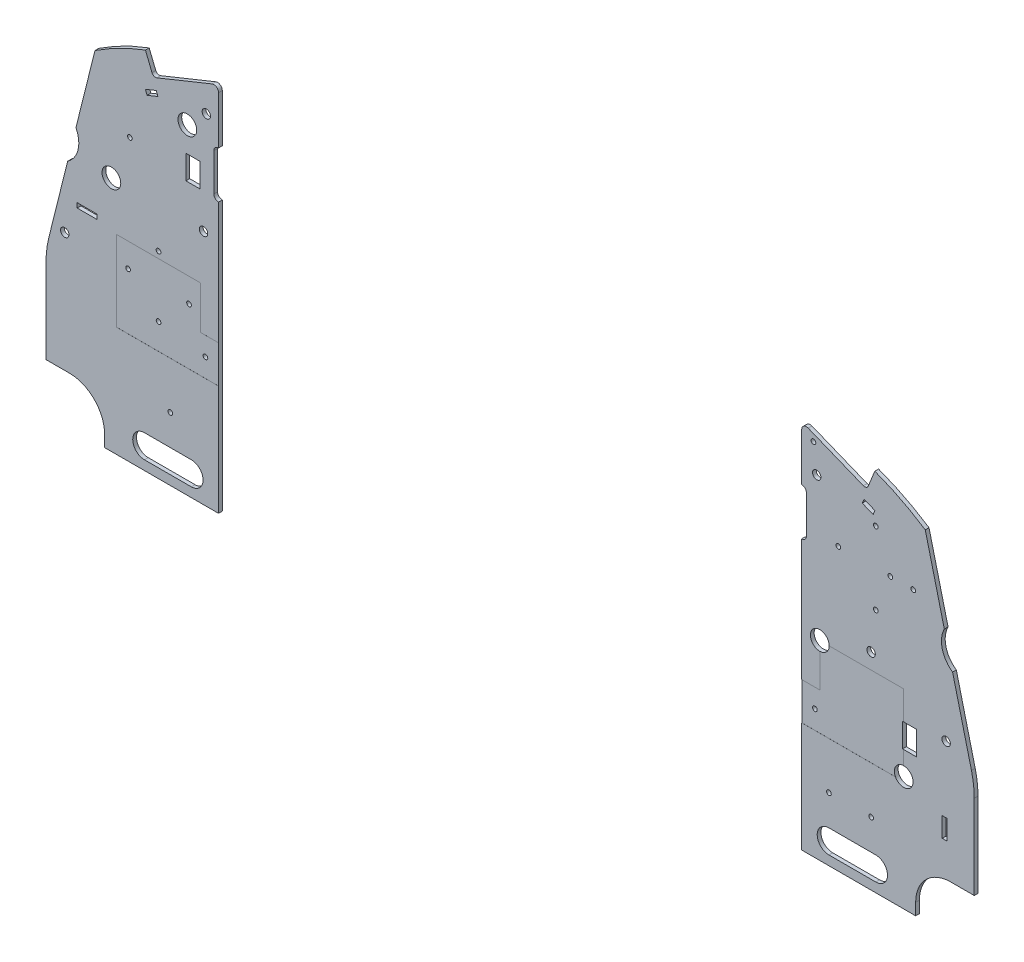
from build123d import *

# Parameters (mm, degrees)
AUFSATZ_LINEAR_AUSTRAGEN1_DEPTH      = 0.8
VERRUNDUNG1_R                        = 20
VERRUNDUNG3_R                        = 1
SKIZZE4_R                            = 5.5
SCHNITT_LINEAR_AUSTRAGEN2_DEPTH      = 130.32802365
SCHNITT_LINEAR_AUSTRAGEN3_DEPTH      = 130.32802365
SCHNITT_LINEAR_AUSTRAGEN3_DEPTH_BACK = 130.32802365
SKIZZE5_R                            = 0.5
VERRUNDUNG4_R                        = 0.8
SKIZZE3_R                            = 0.9
SKIZZE3_R_2                          = 2
SKIZZE3_R_3                          = 0.5
SKIZZE3_W                            = 3
SKIZZE3_H                            = 5.1
SKIZZE3_W_2                          = 4.20290216
SKIZZE3_H_2                          = 1
SKIZZE3_W_3                          = 1
SKIZZE3_H_3                          = 4.201269158
SCHNITT_LINEAR_AUSTRAGEN1_DEPTH      = 130.32802365
SCHNITT_LINEAR_AUSTRAGEN4_DEPTH      = 0.01


with BuildPart() as part:
    # Skizze2 → Aufsatz-Linear austragen1 (new body)
    with BuildSketch(Plane.XY.offset(13.9)):
        with BuildLine():
            Line((-94, 14.5), (-99, 14.5))
            Line((-99, 14.5), (-99, 34.929108521))
            Line((-99, 34.929108521), (-88.553693359, 76.826956023))
            ThreePointArc((-88.553693359, 76.826956023), (-83.331016666, 79.871233051), (-77.790323379, 82.288812905))
            Line((-77.790323379, 82.288812905), (-76.090498469, 78.081598618))
            Line((-76.090498469, 78.081598618), (-62.2, 83.693724289))
            Line((-62.2, 83.693724289), (-62.2, 4.5))
            Line((-62.2, 4.5), (-86.5, 4.5))
            Line((-86.5, 4.5), (-86.5, 7))
            ThreePointArc((-86.5, 7), (-88.696699141, 12.303300859), (-94, 14.5))
        make_face()
    extrude(amount=-AUFSATZ_LINEAR_AUSTRAGEN1_DEPTH)

    # Verrundung1
    verrundung1_edges = [part.edges().sort_by_distance(p)[0] for p in [
        (-99, 34.929108521, 13.5),
    ]]
    fillet(verrundung1_edges, radius=VERRUNDUNG1_R)

    # Verrundung3
    verrundung3_edges = [part.edges().sort_by_distance(p)[0] for p in [
        (-62.2, 83.693724289, 13.5),
    ]]
    fillet(verrundung3_edges, radius=VERRUNDUNG3_R)

    # Skizze4 → Schnitt-Linear austragen2 (cut, through all)
    with BuildSketch(Plane.XY.offset(13.9)):
        with Locations((-97.5, 58)):
            Circle(SKIZZE4_R)
    extrude(amount=-SCHNITT_LINEAR_AUSTRAGEN2_DEPTH, mode=Mode.SUBTRACT)

    # Skizze5 → Schnitt-Linear austragen3 (cut, two sides: drawn at the far end of the back side and taken through both)
    with BuildSketch(Plane.XY.offset(13.9).offset(-SCHNITT_LINEAR_AUSTRAGEN3_DEPTH_BACK)):
        with Locations((-65, 32)):
            Circle(SKIZZE5_R)
        with Locations((-81.1, 64.5)):
            Circle(SKIZZE5_R)
        with BuildLine():
            Line((-63.2, 63), (-63.2, 71))
            ThreePointArc((-63.2, 71), (-62.2, 72), (-61.2, 71))
            Line((-61.2, 71), (-61.2, 63))
            ThreePointArc((-61.2, 63), (-62.2, 62), (-63.2, 63))
        make_face()
        with BuildLine():
            Line((-78, 11.5), (-68, 11.5))
            ThreePointArc((-68, 11.5), (-65.5, 9), (-68, 6.5))
            Line((-68, 6.5), (-78, 6.5))
            ThreePointArc((-78, 6.5), (-80.5, 9), (-78, 11.5))
        make_face()
        Polygon((-77.808979818, 75.031741758), (-77.434373225, 74.104557904), (-75.116413588, 75.041074387), (-75.491020182, 75.968258242), align=None)
    extrude(amount=SCHNITT_LINEAR_AUSTRAGEN3_DEPTH + SCHNITT_LINEAR_AUSTRAGEN3_DEPTH_BACK, mode=Mode.SUBTRACT)

    # Verrundung4
    verrundung4_edges = [part.edges().sort_by_distance(p)[0] for p in [
        (-76.090498469, 78.081598618, 13.5),
    ]]
    fillet(verrundung4_edges, radius=VERRUNDUNG4_R)


with BuildPart() as body_2:
    # Spiegeln1: mirrored copy
    add(part.part.mirror(Plane(origin=(0, 0, 0), x_dir=(0, 0, 1), z_dir=(1, 0, 0))))


with BuildPart() as schnitt_linear_austragen1_tool:
    # Skizze3 → Schnitt-Linear austragen1 (new, through all)
    with BuildSketch(Plane.XY.offset(13.9)):
        with Locations((-64.8, 77)):
            Circle(SKIZZE3_R)
        with Locations((-68.85, 72.95)):
            Circle(SKIZZE3_R_2)
        with Locations((-85.05, 55.05)):
            Circle(SKIZZE3_R_2)
        with Locations((-65.4, 55)):
            Circle(SKIZZE3_R)
        with Locations((-95, 40)):
            Circle(SKIZZE3_R)
        with Locations((65.4, 75.4)):
            Circle(SKIZZE3_R)
        with Locations((77, 48.5)):
            Circle(SKIZZE3_R)
        with Locations((66.05, 45.15)):
            Circle(SKIZZE3_R_2)
        with Locations((83.95, 28.95)):
            Circle(SKIZZE3_R_2)
        with Locations((93, 40)):
            Circle(SKIZZE3_R)
        with Locations((64.7, 81.2)):
            Circle(SKIZZE3_R_3)
        with Locations((78, 72.250000005)):
            Circle(SKIZZE3_R_3)
        with Locations((86, 64.500000005)):
            Circle(SKIZZE3_R_3)
        with Locations((70, 64.500000005)):
            Circle(SKIZZE3_R_3)
        with Locations((78, 56.750000005)):
            Circle(SKIZZE3_R_3)
        with Locations((68, 18)):
            Circle(SKIZZE3_R_3)
        with Locations((77, 18)):
            Circle(SKIZZE3_R_3)
        with Locations((-72.5, 18)):
            Circle(SKIZZE3_R_3)
        with Locations((-75, 33.527236218)):
            Circle(SKIZZE3_R_3)
        with Locations((-81.5, 40.027236218)):
            Circle(SKIZZE3_R_3)
        with Locations((-68.5, 40.027236218)):
            Circle(SKIZZE3_R_3)
        with Locations((-75, 46.527236218)):
            Circle(SKIZZE3_R_3)
        with Locations((-67.65, 65)):
            Rectangle(SKIZZE3_W, SKIZZE3_H)
        with Locations((-90.24854892, 46.327042662)):
            Rectangle(SKIZZE3_W_2, SKIZZE3_H_2)
        with Locations((92.672138894, 23.750634579)):
            Rectangle(SKIZZE3_W_3, SKIZZE3_H_3)
        with Locations((85.2, 36.5)):
            Rectangle(SKIZZE3_W, SKIZZE3_H)
    extrude(amount=-SCHNITT_LINEAR_AUSTRAGEN1_DEPTH)


with BuildPart() as part_1:
    add(part.part)

    # Schnitt-Linear austragen1: cut by schnitt_linear_austragen1_tool
    add(schnitt_linear_austragen1_tool.part, mode=Mode.SUBTRACT)


with BuildPart() as body_2_1:
    add(body_2.part)

    # Schnitt-Linear austragen1: cut by schnitt_linear_austragen1_tool
    add(schnitt_linear_austragen1_tool.part, mode=Mode.SUBTRACT)


with BuildPart() as schnitt_linear_austragen4_tool:
    # Skizze6 → Schnitt-Linear austragen4 (new body)
    with BuildSketch(Plane.XY.offset(13.9)):
        Polygon((83.943356235, 45.15), (83.943356235, 28.012211583), (54.650229585, 28.012211583), (54.650229585, 36.000899632), (66.05, 36.000899632), (66.05, 45.15), align=None)
        Polygon((-66.05, 45.15), (-83.943356235, 45.15), (-83.943356235, 28.012211583), (-54.650229585, 28.012211583), (-54.650229585, 36.000899632), (-66.05, 36.000899632), align=None)
    extrude(amount=-SCHNITT_LINEAR_AUSTRAGEN4_DEPTH)


with BuildPart() as part_2:
    add(part_1.part)

    # Schnitt-Linear austragen4: cut by schnitt_linear_austragen4_tool
    add(schnitt_linear_austragen4_tool.part, mode=Mode.SUBTRACT)


with BuildPart() as body_2_2:
    add(body_2_1.part)

    # Schnitt-Linear austragen4: cut by schnitt_linear_austragen4_tool
    add(schnitt_linear_austragen4_tool.part, mode=Mode.SUBTRACT)


solid = Compound([part_2.part, body_2_2.part])
